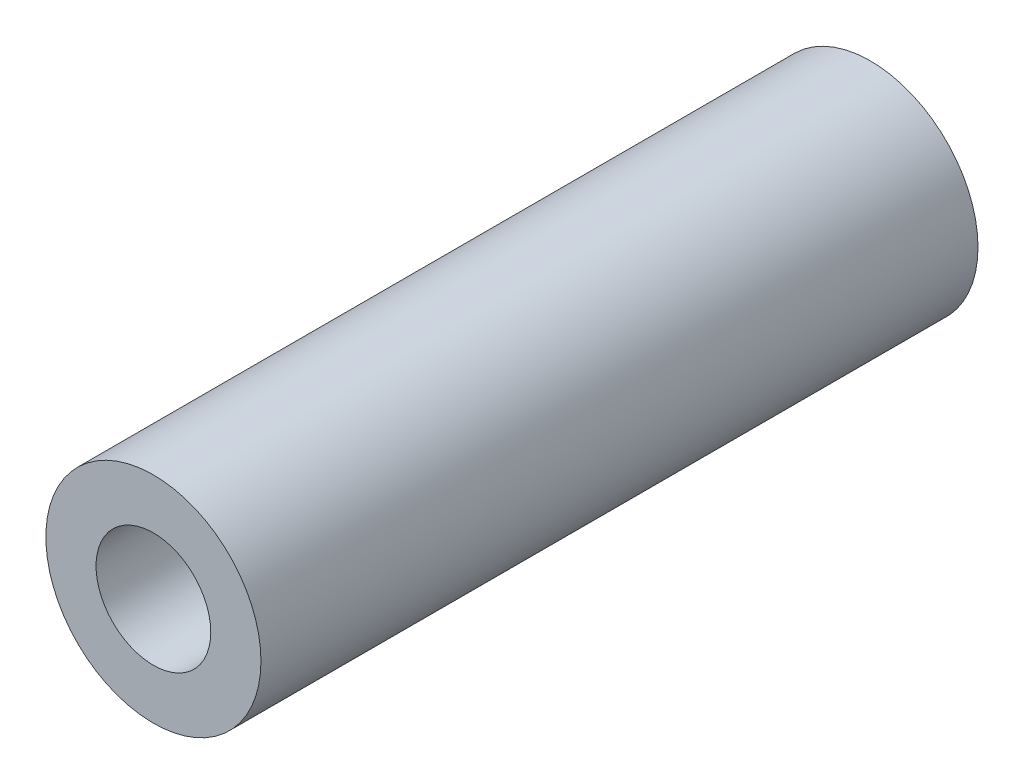
from build123d import *

# Parameters (mm, degrees)
SKETCH_1_R          = 7.5
EXTRUDE_1_DEPTH     = 50
SKETCH_2_R          = 4
CUT_EXTRUDE_1_DEPTH = 30


with BuildPart() as part:
    # 스케치1 → 보스-돌출1 (new body)
    with BuildSketch(Plane.XY):
        Circle(SKETCH_1_R)
    extrude(amount=EXTRUDE_1_DEPTH)

    # 스케치2 → 컷-돌출1 (cut)
    with BuildSketch(Plane.XY.offset(50)):
        Circle(SKETCH_2_R)
    extrude(amount=-CUT_EXTRUDE_1_DEPTH, mode=Mode.SUBTRACT)


solid = part.part
